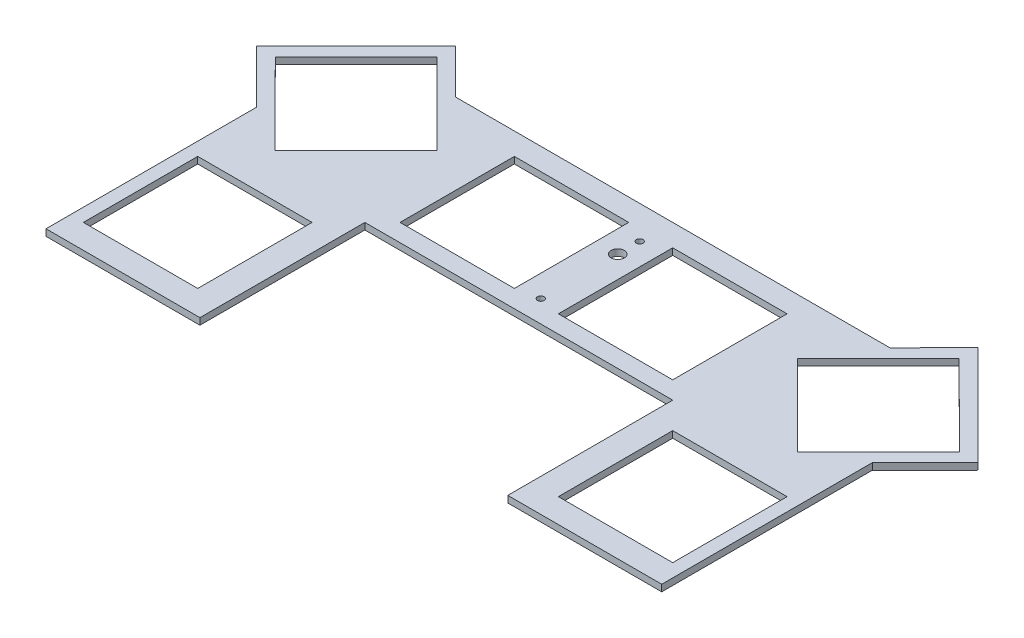
from build123d import *
from build123d.topology import SkipClean

# Parameters (mm, degrees)
SKETCH_1_W      = 52
SKETCH_1_H      = 52
EXTRUDE_1_DEPTH = 3


with BuildPart() as part:
    # 草图1 → 凸台-拉伸1 (new body)
    with BuildSketch(Plane(origin=(0, 0, 0), x_dir=(1, 0, 0), z_dir=(0, 1, 0))):
        with BuildLine():
            Line((-140, -50), (-70, -50))
            Line((-70, -50), (-70, 25))
            Line((-70, 25), (0, 25))
            Line((0, 25), (0, 33.5))
            ThreePointArc((0, 33.5), (-1.5, 35), (0, 36.5))
            Line((0, 36.5), (0, 67))
            ThreePointArc((0, 67), (-3, 70), (0, 73))
            Line((0, 73), (0, 78.5))
            ThreePointArc((0, 78.5), (-1.5, 80), (0, 81.5))
            Line((0, 81.5), (0, 95))
            Line((0, 95), (-98.740841322, 95))
            Line((-98.740841322, 95), (-118.732050781, 115.024358473))
            Line((-118.732050781, 115.024358473), (-164.024358473, 69.80702923))
            Line((-164.024358473, 69.80702923), (-140, 45.742834058))
            Line((-140, 45.742834058), (-140, -50))
        make_face()
        Polygon((-82, 69.73908001), (-118.8, 33), (-155.53908001, 69.8), (-118.73908001, 106.53908001), align=None, mode=Mode.SUBTRACT)
        with Locations((-36, 59)):
            Rectangle(SKETCH_1_W, SKETCH_1_H, mode=Mode.SUBTRACT)
        with Locations((-108, -13)):
            Rectangle(SKETCH_1_W, SKETCH_1_H, mode=Mode.SUBTRACT)
    extrude_1 = extrude(amount=EXTRUDE_1_DEPTH)

    # 镜向1: 凸台-拉伸1 across plane
    with SkipClean():  # the faces are left unmerged after this step: merging them gives an invalid solid
        add(extrude_1.mirror(Plane(origin=(0, 3, -36.5), x_dir=(0, 0, 1), z_dir=(-1, 0, 0))))


solid = part.part
